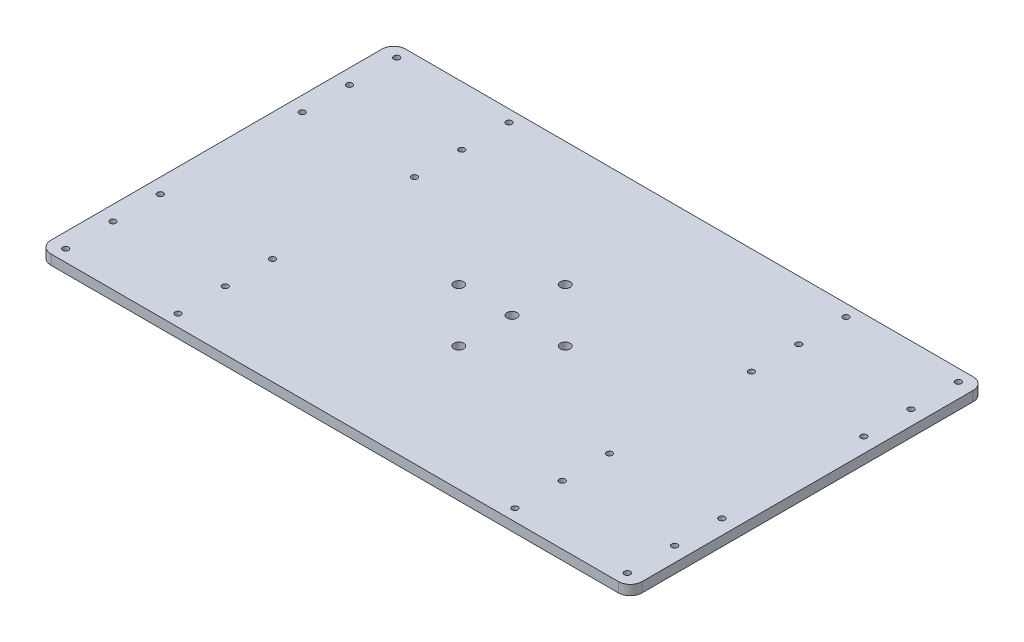
from build123d import *

# Parameters (mm, degrees)
SKETCH1_R           = 1.5
SKETCH1_R_2         = 2.5
BOSS_EXTRUDE1_DEPTH = 5


with BuildPart() as part:
    # Sketch1 → Boss-Extrude1 (new body)
    with BuildSketch(Plane(origin=(0, 0, 0), x_dir=(1, 0, 0), z_dir=(0, 1, 0))):
        with BuildLine():
            Line((-144, -90), (144, -90))
            ThreePointArc((144, -90), (148.242640687, -88.242640687), (150, -84))
            Line((150, -84), (150, 84))
            ThreePointArc((150, 84), (148.242640687, 88.242640687), (144, 90))
            Line((144, 90), (-144, 90))
            ThreePointArc((-144, 90), (-148.242640687, 88.242640687), (-150, 84))
            Line((-150, 84), (-150, -84))
            ThreePointArc((-150, -84), (-148.242640687, -88.242640687), (-144, -90))
        make_face()
        with Locations(Location((-142.5, 84, 0), (0, 0, 270))):
            Circle(SKETCH1_R, mode=Mode.SUBTRACT)
        with Locations(Location((-142.5, 60, 0), (0, 0, 270))):
            Circle(SKETCH1_R, mode=Mode.SUBTRACT)
        with Locations(Location((-142.5, 36, 0), (0, 0, 270))):
            Circle(SKETCH1_R, mode=Mode.SUBTRACT)
        with Locations(Location((-85.5, 84, 0), (0, 0, 270))):
            Circle(SKETCH1_R, mode=Mode.SUBTRACT)
        with Locations(Location((-85.5, 60, 0), (0, 0, 270))):
            Circle(SKETCH1_R, mode=Mode.SUBTRACT)
        with Locations(Location((-85.5, 36, 0), (0, 0, 270))):
            Circle(SKETCH1_R, mode=Mode.SUBTRACT)
        with Locations(Location((85.5, 36, 0), (0, 0, 90))):
            Circle(SKETCH1_R, mode=Mode.SUBTRACT)
        with Locations(Location((85.5, 60, 0), (0, 0, 90))):
            Circle(SKETCH1_R, mode=Mode.SUBTRACT)
        with Locations(Location((85.5, 84, 0), (0, 0, 90))):
            Circle(SKETCH1_R, mode=Mode.SUBTRACT)
        with Locations(Location((142.5, 36, 0), (0, 0, 90))):
            Circle(SKETCH1_R, mode=Mode.SUBTRACT)
        with Locations(Location((142.5, 60, 0), (0, 0, 90))):
            Circle(SKETCH1_R, mode=Mode.SUBTRACT)
        with Locations(Location((142.5, 84, 0), (0, 0, 90))):
            Circle(SKETCH1_R, mode=Mode.SUBTRACT)
        with Locations(Location((142.5, -84, 0), (0, 0, 270))):
            Circle(SKETCH1_R, mode=Mode.SUBTRACT)
        with Locations(Location((142.5, -60, 0), (0, 0, 270))):
            Circle(SKETCH1_R, mode=Mode.SUBTRACT)
        with Locations(Location((142.5, -36, 0), (0, 0, 270))):
            Circle(SKETCH1_R, mode=Mode.SUBTRACT)
        with Locations(Location((85.5, -84, 0), (0, 0, 270))):
            Circle(SKETCH1_R, mode=Mode.SUBTRACT)
        with Locations(Location((85.5, -60, 0), (0, 0, 270))):
            Circle(SKETCH1_R, mode=Mode.SUBTRACT)
        with Locations(Location((85.5, -36, 0), (0, 0, 270))):
            Circle(SKETCH1_R, mode=Mode.SUBTRACT)
        with Locations(Location((-85.5, -36, 0), (0, 0, 90))):
            Circle(SKETCH1_R, mode=Mode.SUBTRACT)
        with Locations(Location((-85.5, -60, 0), (0, 0, 90))):
            Circle(SKETCH1_R, mode=Mode.SUBTRACT)
        with Locations(Location((-85.5, -84, 0), (0, 0, 90))):
            Circle(SKETCH1_R, mode=Mode.SUBTRACT)
        with Locations(Location((-142.5, -36, 0), (0, 0, 90))):
            Circle(SKETCH1_R, mode=Mode.SUBTRACT)
        with Locations(Location((-142.5, -60, 0), (0, 0, 90))):
            Circle(SKETCH1_R, mode=Mode.SUBTRACT)
        with Locations(Location((-142.5, -84, 0), (0, 0, 90))):
            Circle(SKETCH1_R, mode=Mode.SUBTRACT)
        with Locations(Location((0, 27, 0), (0, 0, 270))):
            Circle(SKETCH1_R_2, mode=Mode.SUBTRACT)
        with Locations(Location((27, 0, 0), (0, 0, 270))):
            Circle(SKETCH1_R_2, mode=Mode.SUBTRACT)
        with Locations(Location((0, -27, 0), (0, 0, 270))):
            Circle(SKETCH1_R_2, mode=Mode.SUBTRACT)
        with Locations(Location((-27, 0, 0), (0, 0, 270))):
            Circle(SKETCH1_R_2, mode=Mode.SUBTRACT)
        with Locations(Location((0, 0, 0), (0, 0, 270))):
            Circle(SKETCH1_R_2, mode=Mode.SUBTRACT)
    extrude(amount=BOSS_EXTRUDE1_DEPTH)


solid = part.part
